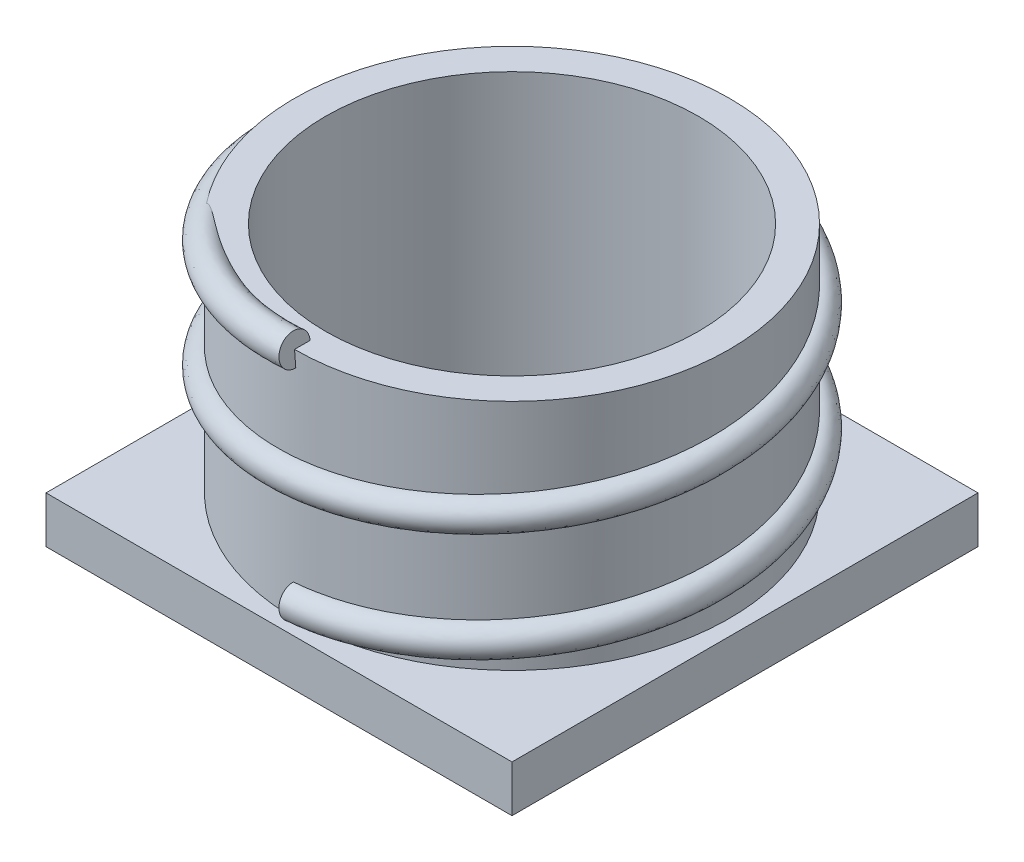
from build123d import *

# Parameters (mm, degrees)
SKETCH1_W           = 38.1
SKETCH1_H           = 38.1
BOSS_EXTRUDE1_DEPTH = 3.81
SKETCH2_R           = 17.78
BOSS_EXTRUDE2_DEPTH = 19.05
SKETCH3_R           = 15.24
CUT_EXTRUDE1_DEPTH  = 36.332486468
SWEEP3_PITCH        = 8.89
SWEEP3_HEIGHT       = 17.78
SWEEP3_RADIUS       = 17.78
SWEEP3_START_ANGLE  = -180
SWEEP3_PROFILE_R    = 1.27


with BuildPart() as part:
    # Sketch1 → Boss-Extrude1 (new body)
    with BuildSketch(Plane(origin=(0, 0, 0), x_dir=(1, 0, 0), z_dir=(0, 1, 0))):
        Rectangle(SKETCH1_W, SKETCH1_H)
    extrude(amount=BOSS_EXTRUDE1_DEPTH)

    # Sketch2 → Boss-Extrude2 (add)
    with BuildSketch(Plane(origin=(0, 3.81, 0), x_dir=(1, 0, 0), z_dir=(0, 1, 0))):
        with Locations(Location((0, 0, 0), (0, 0, 90))):
            Circle(SKETCH2_R)
    extrude(amount=BOSS_EXTRUDE2_DEPTH)

    # Sketch3 → Cut-Extrude1 (cut, through all)
    with BuildSketch(Plane(origin=(0, 22.86, 0), x_dir=(1, 0, 0), z_dir=(0, 1, 0))):
        with Locations(Location((0, 0, 0), (0, 0, 270))):
            Circle(SKETCH3_R)
    extrude(amount=-CUT_EXTRUDE1_DEPTH, mode=Mode.SUBTRACT)

    # Sweep3: sweep along a helix
    with BuildLine() as sweep3_path:
        add(Helix(SWEEP3_PITCH, SWEEP3_HEIGHT, SWEEP3_RADIUS, center=(0, 22.86, 0), direction=(0, -1, 0), mode=Mode.PRIVATE).rotate(Axis((0, 22.86, 0), (0, -1, 0)), SWEEP3_START_ANGLE))
    # Sweep3 profile (on start of the path) → Sweep3 (sweep)
    with BuildSketch(Plane(origin=(0, 22.86, 17.78), x_dir=(0.07932669684315694, -0.996848672150369, 0), z_dir=(-0.996848672150369, -0.07932669684315694, 2.4486598835775666e-13))):
        Circle(SWEEP3_PROFILE_R)
    sweep(path=sweep3_path.line, is_frenet=True)


solid = part.part
